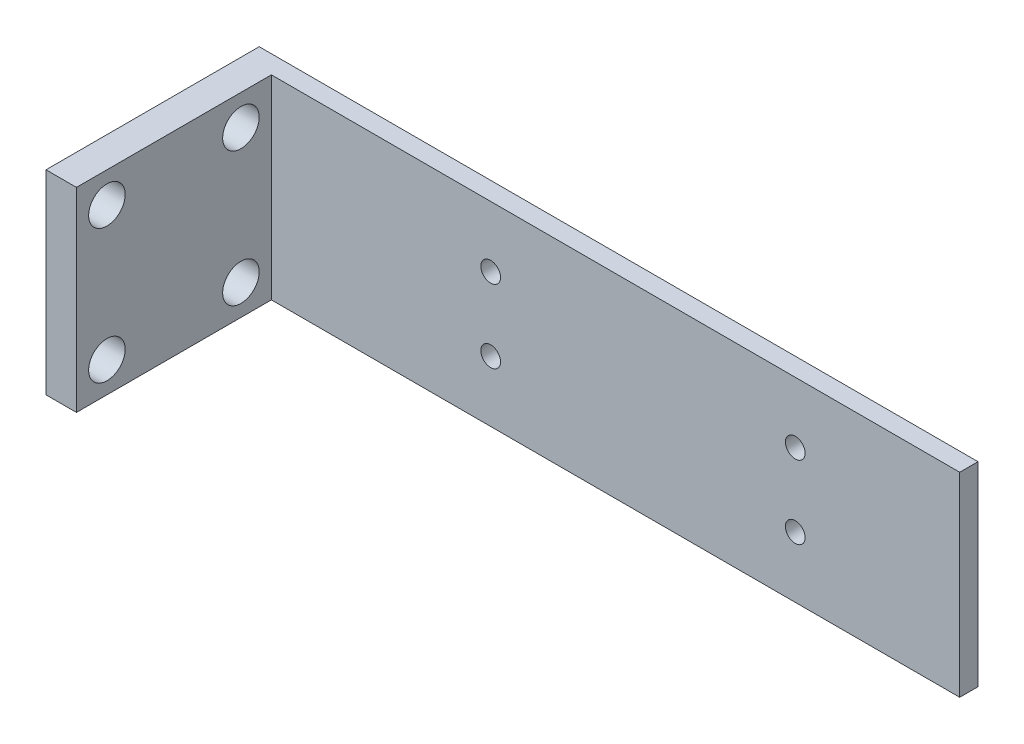
from build123d import *

# Parameters (mm, degrees)
SKETCH_1_W          = 118
SKETCH_1_H          = 32
EXTRUDE_1_DEPTH     = 3
SKETCH_2_R          = 1.62
CUT_EXTRUDE_1_DEPTH = 3
SKETCH_3_W          = 5
SKETCH_3_H          = 32
EXTRUDE_2_DEPTH     = 32
SKETCH_4_R          = 3
CUT_EXTRUDE_2_DEPTH = 32


with BuildPart() as part:
    # 草图1 → 凸台-拉伸1 (new body)
    with BuildSketch(Plane.XY):
        with Locations((-12.281632653, 6.717006803)):
            Rectangle(SKETCH_1_W, SKETCH_1_H)
    extrude(amount=EXTRUDE_1_DEPTH)

    # 草图2 → 切除-拉伸1 (cut)
    with BuildSketch(Plane.XY.offset(3)):
        with Locations((-30.281632653, 12.717006803)):
            Circle(SKETCH_2_R)
        with Locations((-30.281632653, 0.717006803)):
            Circle(SKETCH_2_R)
        with Locations((19.718367347, 12.717006803)):
            Circle(SKETCH_2_R)
        with Locations((19.718367347, 0.717006803)):
            Circle(SKETCH_2_R)
    extrude(amount=-CUT_EXTRUDE_1_DEPTH, mode=Mode.SUBTRACT)

    # 草图3 → 凸台-拉伸2 (add)
    with BuildSketch(Plane.XY.offset(3)):
        with Locations((-68.781632653, 6.717006803)):
            Rectangle(SKETCH_3_W, SKETCH_3_H)
    extrude(amount=EXTRUDE_2_DEPTH)

    # 草图4 → 切除-拉伸2 (cut)
    with BuildSketch(Plane.ZY.offset(71.281632653)):
        with Locations((30, 17.717006803)):
            Circle(SKETCH_4_R)
        with Locations((30, -4.282993197)):
            Circle(SKETCH_4_R)
        with Locations((8, 17.717006803)):
            Circle(SKETCH_4_R)
        with Locations((8, -4.282993197)):
            Circle(SKETCH_4_R)
    extrude(amount=-CUT_EXTRUDE_2_DEPTH, mode=Mode.SUBTRACT)


solid = part.part
